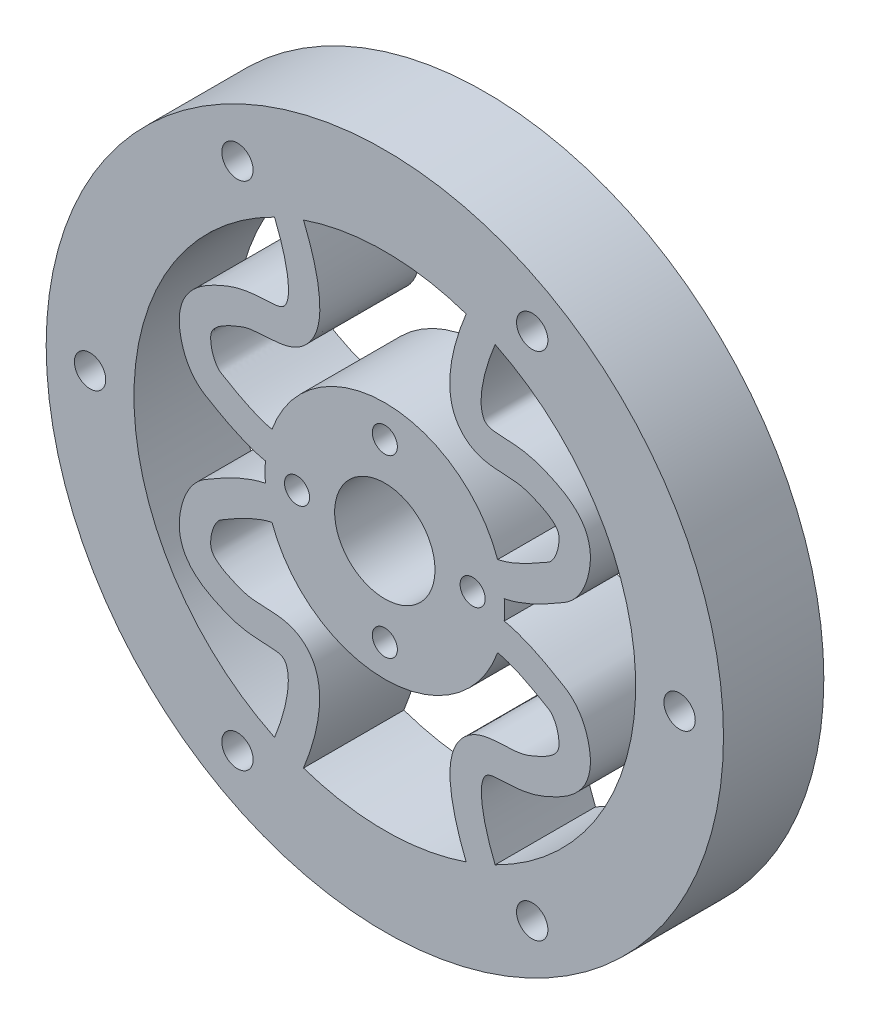
from build123d import *

# Parameters (mm, degrees)
SKETCH1_R           = 27
SKETCH1_R_2         = 4
SKETCH1_R_3         = 1
SKETCH1_R_4         = 1.25
BOSS_EXTRUDE1_DEPTH = 8


with BuildPart() as part:
    # Sketch1 → Boss-Extrude1 (new body)
    with BuildSketch(Plane.XY):
        Circle(SKETCH1_R)
        Circle(SKETCH1_R_2, mode=Mode.SUBTRACT)
        with Locations((0, 7)):
            Circle(SKETCH1_R_3, mode=Mode.SUBTRACT)
        with Locations((7, 0)):
            Circle(SKETCH1_R_3, mode=Mode.SUBTRACT)
        with Locations((0, -7)):
            Circle(SKETCH1_R_3, mode=Mode.SUBTRACT)
        with Locations((-7, 0)):
            Circle(SKETCH1_R_3, mode=Mode.SUBTRACT)
        with Locations((23.5, 0)):
            Circle(SKETCH1_R_4, mode=Mode.SUBTRACT)
        with Locations((-11.75, -20.351596989)):
            Circle(SKETCH1_R_4, mode=Mode.SUBTRACT)
        with Locations((-11.75, 20.351596989)):
            Circle(SKETCH1_R_4, mode=Mode.SUBTRACT)
        with Locations((11.75, -20.351596989)):
            Circle(SKETCH1_R_4, mode=Mode.SUBTRACT)
        with Locations((-23.5, 0)):
            Circle(SKETCH1_R_4, mode=Mode.SUBTRACT)
        with Locations((11.75, 20.351596989)):
            Circle(SKETCH1_R_4, mode=Mode.SUBTRACT)
        with BuildLine():
            ThreePointArc((-9.519212073, 0.770746505), (-9.550363798, 0), (-9.519212073, -0.770746505))
            add(Edge.make_bspline(
                [(-8.79295489, -17.963459402), (-8.789751676, -17.955605283), (-8.756493011, -17.873910254), (-8.674658323, -17.668827597), (-8.47314353, -17.139202024), (-8.181522342, -16.282172452), (-7.873324992, -15.126888182), (-7.687935236, -13.981580908), (-7.686485968, -12.989186569), (-7.881874013, -12.340800811), (-8.105008022, -12.102135272), (-8.426726621, -11.93662341), (-9.255330049, -11.874056746), (-10.061437086, -11.847182272), (-10.979976732, -11.781328167), (-12.037311083, -11.549131456), (-12.900840134, -11.200679798), (-14.053782574, -10.681805535), (-15.230761942, -9.925378086), (-16.128503078, -8.662385101), (-16.433335649, -7.420441445), (-16.36142636, -6.267389777), (-16.068501517, -5.081799092), (-15.596339324, -4.13538804), (-15.106075273, -3.536707787), (-14.774414654, -3.228408392), (-14.488087887, -3.013403395), (-14.214054149, -2.848285897), (-13.840047195, -2.635954373), (-12.932323329, -2.101933051), (-11.3829493, -1.322801643), (-10.154589961, -0.901693789), (-9.522133979, -0.771346853), (-9.519212073, -0.770746505)],
                knots=[0.008784753, 0.008784753, 0.008784753, 0.008784753, 0.01097773, 0.03125, 0.0625, 0.125, 0.1875, 0.25, 0.3125, 0.375, 0.4375, 0.5, 0.53125, 0.5625, 0.59375, 0.625, 0.65625, 0.6875, 0.75, 0.78125, 0.8125, 0.84375, 0.875, 0.90625, 0.921875, 0.9296875, 0.9375, 0.9453125, 0.953125, 0.96875, 0.984375, 0.999644738, 0.99971544, 0.99971544, 0.99971544, 0.99971544], degree=3))
            ThreePointArc((-8.79295489, -17.963459402), (-20.000048234, 9.463e-06), (-8.792937891, 17.963467723))
            add(Edge.make_bspline(
                [(-8.792937891, 17.963467723), (-8.791562262, 17.960126215), (-8.750267497, 17.859747013), (-8.65833601, 17.631351501), (-8.441705375, 17.063028934), (-8.149451429, 16.205056503), (-7.846325361, 15.06368757), (-7.668843885, 13.941955129), (-7.675333506, 12.978050771), (-7.87114636, 12.35652349), (-8.095991929, 12.116873434), (-8.436711213, 11.945998932), (-9.265416298, 11.87785087), (-10.068596518, 11.844262449), (-10.982441815, 11.771781418), (-12.031590736, 11.537373891), (-12.892434133, 11.191428265), (-14.045189381, 10.676092497), (-15.224558498, 9.925230094), (-16.126936546, 8.663277488), (-16.432671595, 7.419151394), (-16.360416899, 6.266683054), (-16.067771702, 5.081083432), (-15.595558083, 4.134593177), (-15.105045207, 3.535835762), (-14.773209288, 3.227530288), (-14.486711652, 3.012529547), (-14.212708995, 2.847515376), (-13.83888204, 2.635324178), (-12.931623587, 2.101508088), (-11.382941981, 1.322630304), (-10.154652478, 0.901642716), (-9.522145294, 0.771348875), (-9.519212073, 0.770746505)],
                knots=[0.003708072, 0.003708072, 0.003708072, 0.003708072, 0.00463509, 0.03125, 0.0625, 0.125, 0.1875, 0.25, 0.3125, 0.375, 0.4375, 0.5, 0.53125, 0.5625, 0.59375, 0.625, 0.65625, 0.6875, 0.75, 0.78125, 0.8125, 0.84375, 0.875, 0.90625, 0.921875, 0.9296875, 0.9375, 0.9453125, 0.953125, 0.96875, 0.984375, 0.999645143, 0.999716115, 0.999716115, 0.999716115, 0.999716115], degree=3))
        make_face(mode=Mode.SUBTRACT)
        with BuildLine():
            ThreePointArc((-8.992854355, -3.215279027), (0, -9.550363798), (8.992854355, -3.215279027))
            add(Edge.make_bspline(
                [(6.482825594, -18.920224673), (6.479643079, -18.912434621), (6.440546178, -18.816583376), (6.346672928, -18.581652119), (6.118118263, -17.980808102), (5.788945543, -17.014197955), (5.428868329, -15.668883374), (5.191072918, -14.23051065), (5.174743858, -12.762208605), (5.523807656, -11.283682639), (6.409177328, -10.167424688), (7.453609958, -9.625573421), (8.349527017, -9.425951182), (9.169805236, -9.377043055), (9.947175883, -9.35117047), (10.674740736, -9.289097944), (11.236716988, -9.1697411), (11.931555202, -8.897082405), (12.637231679, -8.577618745), (13.211384932, -8.234205944), (13.612717299, -7.883089355), (13.812647465, -7.570728835), (13.896433602, -7.282600511), (13.879165384, -6.642379878), (13.730051718, -6.060720657), (13.551428988, -5.654040983), (13.396387154, -5.397598774), (13.264974828, -5.239502142), (13.160322976, -5.144344514), (13.101616979, -5.099234995), (12.979350793, -5.022822963), (12.577708218, -4.794184261), (11.724478645, -4.292467827), (10.60082367, -3.731233705), (9.652287875, -3.377819408), (9.219303852, -3.260663105), (8.992854355, -3.215279027)],
                knots=[0.007766771, 0.007766771, 0.007766771, 0.007766771, 0.009702959, 0.03125, 0.0625, 0.125, 0.1875, 0.25, 0.3125, 0.375, 0.4375, 0.46875, 0.5, 0.53125, 0.5625, 0.59375, 0.625, 0.65625, 0.6875, 0.71875, 0.75, 0.78125, 0.8125, 0.84375, 0.875, 0.890625, 0.90625, 0.921875, 0.9296875, 0.9375, 0.9453125, 0.953125, 0.96875, 0.984375, 0.9921875, 1, 1, 1, 1], degree=3))
            ThreePointArc((6.482825594, -18.920224673), (0, -20.000048234), (-6.482825594, -18.920224673))
            add(Edge.make_bspline(
                [(-6.482825594, -18.920224673), (-6.479643079, -18.912434621), (-6.440546178, -18.816583376), (-6.346672928, -18.581652119), (-6.118118263, -17.980808102), (-5.788945543, -17.014197955), (-5.428868329, -15.668883374), (-5.191072918, -14.23051065), (-5.174743858, -12.762208605), (-5.523807656, -11.283682639), (-6.409177328, -10.167424688), (-7.453609958, -9.625573421), (-8.349527017, -9.425951182), (-9.169805236, -9.377043055), (-9.947175883, -9.35117047), (-10.674740736, -9.289097944), (-11.236716988, -9.1697411), (-11.931555202, -8.897082405), (-12.637231679, -8.577618745), (-13.211384932, -8.234205944), (-13.612717299, -7.883089355), (-13.812647465, -7.570728835), (-13.896433602, -7.282600511), (-13.879165384, -6.642379878), (-13.730051718, -6.060720657), (-13.551428988, -5.654040983), (-13.396387154, -5.397598774), (-13.264974828, -5.239502142), (-13.160322976, -5.144344514), (-13.101616979, -5.099234995), (-12.979350793, -5.022822963), (-12.577708218, -4.794184261), (-11.724478645, -4.292467827), (-10.60082367, -3.731233705), (-9.652287875, -3.377819408), (-9.219303852, -3.260663105), (-8.992854355, -3.215279027)],
                knots=[0.007766771, 0.007766771, 0.007766771, 0.007766771, 0.009702959, 0.03125, 0.0625, 0.125, 0.1875, 0.25, 0.3125, 0.375, 0.4375, 0.46875, 0.5, 0.53125, 0.5625, 0.59375, 0.625, 0.65625, 0.6875, 0.71875, 0.75, 0.78125, 0.8125, 0.84375, 0.875, 0.890625, 0.90625, 0.921875, 0.9296875, 0.9375, 0.9453125, 0.953125, 0.96875, 0.984375, 0.9921875, 1, 1, 1, 1], degree=3))
        make_face(mode=Mode.SUBTRACT)
        with BuildLine():
            ThreePointArc((9.519212073, -0.770746505), (9.550363798, 0), (9.519212073, 0.770746505))
            add(Edge.make_bspline(
                [(8.793318818, 17.963218379), (8.743197293, 17.842214311), (8.651505868, 17.615364074), (8.428006234, 17.0288406), (8.138008467, 16.176595857), (7.838003211, 15.043395883), (7.663538372, 13.930323334), (7.672414939, 12.974755911), (7.868409236, 12.359721076), (8.094314145, 12.119149537), (8.43980684, 11.946965508), (9.268598186, 11.877488925), (10.071089889, 11.842329001), (10.983787483, 11.768300256), (12.03090242, 11.533397682), (12.891077316, 11.188030214), (14.043721238, 10.673507279), (15.223480966, 9.923979767), (16.126726799, 8.66249373), (16.432612099, 7.418147543), (16.360238965, 6.265833202), (16.067584864, 5.080344546), (15.595419621, 4.133992665), (15.105024713, 3.535339458), (14.77327045, 3.227082767), (14.486871953, 3.012125091), (14.212836921, 2.847074129), (13.838864879, 2.634823466), (12.931475766, 2.101093192), (11.382699658, 1.322441506), (10.154530912, 0.901606325), (9.52215874, 0.771351576), (9.519212073, 0.770746505)],
                knots=[0, 0, 0, 0, 0.03125, 0.0625, 0.125, 0.1875, 0.25, 0.3125, 0.375, 0.4375, 0.5, 0.53125, 0.5625, 0.59375, 0.625, 0.65625, 0.6875, 0.75, 0.78125, 0.8125, 0.84375, 0.875, 0.90625, 0.921875, 0.9296875, 0.9375, 0.9453125, 0.953125, 0.96875, 0.984375, 0.99964347, 0.999714776, 0.999714776, 0.999714776, 0.999714776], degree=3))
            ThreePointArc((8.793318818, 17.963218379), (20.000045481, -0.000234035), (8.79295489, -17.963459402))
            add(Edge.make_bspline(
                [(8.79295489, -17.963459402), (8.789751676, -17.955605283), (8.756493011, -17.873910254), (8.674658323, -17.668827597), (8.47314353, -17.139202024), (8.181522342, -16.282172452), (7.873324992, -15.126888182), (7.687935236, -13.981580908), (7.686485968, -12.989186569), (7.881874013, -12.340800811), (8.105008022, -12.102135272), (8.426726621, -11.93662341), (9.255330049, -11.874056746), (10.061437086, -11.847182272), (10.979976732, -11.781328167), (12.037311083, -11.549131456), (12.900840134, -11.200679798), (14.053782574, -10.681805535), (15.230761942, -9.925378086), (16.128503077, -8.662385101), (16.433335649, -7.420441445), (16.36142636, -6.267389777), (16.068501517, -5.081799092), (15.596339324, -4.13538804), (15.106075273, -3.536707787), (14.774414654, -3.228408392), (14.488087887, -3.013403395), (14.214054149, -2.848285897), (13.840047195, -2.635954373), (12.932323329, -2.101933051), (11.3829493, -1.322801643), (10.154589961, -0.901693789), (9.522133979, -0.771346853), (9.519212073, -0.770746505)],
                knots=[0.008784753, 0.008784753, 0.008784753, 0.008784753, 0.01097773, 0.03125, 0.0625, 0.125, 0.1875, 0.25, 0.3125, 0.375, 0.4375, 0.5, 0.53125, 0.5625, 0.59375, 0.625, 0.65625, 0.6875, 0.75, 0.78125, 0.8125, 0.84375, 0.875, 0.90625, 0.921875, 0.9296875, 0.9375, 0.9453125, 0.953125, 0.96875, 0.984375, 0.999644738, 0.99971544, 0.99971544, 0.99971544, 0.99971544], degree=3))
        make_face(mode=Mode.SUBTRACT)
        with BuildLine():
            ThreePointArc((8.992854355, 3.215279027), (0, 9.550363798), (-8.992854355, 3.215279027))
            add(Edge.make_bspline(
                [(-6.482730882, 18.920257125), (-6.481357821, 18.916924027), (-6.434399602, 18.802861466), (-6.330701066, 18.545377344), (-6.087016997, 17.906029612), (-5.756543802, 16.936809876), (-5.400327587, 15.600833855), (-5.170127048, 14.178161761), (-5.163909696, 12.726649856), (-5.528940794, 11.262631501), (-6.421625851, 10.168582686), (-7.456414954, 9.637035594), (-8.34310286, 9.435914775), (-9.158963912, 9.380779136), (-9.934006751, 9.348462034), (-10.661569297, 9.281317237), (-11.22941997, 9.15835602), (-11.927728827, 8.885014141), (-12.635544248, 8.566793201), (-13.211423415, 8.225093601), (-13.613053058, 7.876062007), (-13.811677363, 7.566988268), (-13.894989912, 7.282057166), (-13.877739641, 6.640738219), (-13.728682956, 6.059400104), (-13.550186706, 5.652972791), (-13.395244724, 5.396758929), (-13.263897961, 5.238802562), (-13.15922722, 5.143680622), (-13.100472232, 5.098556794), (-12.977942664, 5.022027734), (-12.576086656, 4.793326813), (-11.723279322, 4.29180674), (-10.600317935, 3.730910578), (-9.65222819, 3.377728779), (-9.219265154, 3.260629732), (-8.992854355, 3.215279027)],
                knots=[0.003301299, 0.003301299, 0.003301299, 0.003301299, 0.004126624, 0.03125, 0.0625, 0.125, 0.1875, 0.25, 0.3125, 0.375, 0.4375, 0.46875, 0.5, 0.53125, 0.5625, 0.59375, 0.625, 0.65625, 0.6875, 0.71875, 0.75, 0.78125, 0.8125, 0.84375, 0.875, 0.890625, 0.90625, 0.921875, 0.9296875, 0.9375, 0.9453125, 0.953125, 0.96875, 0.984375, 0.9921875, 1, 1, 1, 1], degree=3))
            ThreePointArc((-6.482730882, 18.920257125), (0.000281493, 20.000048232), (6.48326347, 18.920074634))
            add(Edge.make_bspline(
                [(6.48326347, 18.920074634), (6.426969184, 18.784168204), (6.323926396, 18.529240191), (6.073238618, 17.871328767), (5.744805977, 16.907111706), (5.391475966, 15.577966261), (5.164397524, 14.161929714), (5.161437973, 12.715977906), (5.530830467, 11.256294227), (6.425185299, 10.167861151), (7.457773191, 9.638640592), (8.342471897, 9.437117849), (9.157349955, 9.380525303), (9.931849038, 9.346695933), (10.659368927, 9.278355576), (11.228458067, 9.154567491), (11.927518469, 8.881074749), (12.635776715, 8.563143177), (13.211970046, 8.221868708), (13.613558474, 7.873391688), (13.811756524, 7.565229996), (13.894899912, 7.281280641), (13.877647996, 6.639933014), (13.728566933, 6.058675927), (13.550080559, 5.652289851), (13.395162417, 5.396116901), (13.263855365, 5.238202934), (13.159243026, 5.143126111), (13.100533395, 5.098033712), (12.978142673, 5.021581255), (12.576396259, 4.792966806), (11.723496187, 4.291557777), (10.600391857, 3.730785638), (9.652220864, 3.377684544), (9.219264876, 3.260618657), (8.992854355, 3.215279027)],
                knots=[0, 0, 0, 0, 0.03125, 0.0625, 0.125, 0.1875, 0.25, 0.3125, 0.375, 0.4375, 0.46875, 0.5, 0.53125, 0.5625, 0.59375, 0.625, 0.65625, 0.6875, 0.71875, 0.75, 0.78125, 0.8125, 0.84375, 0.875, 0.890625, 0.90625, 0.921875, 0.9296875, 0.9375, 0.9453125, 0.953125, 0.96875, 0.984375, 0.9921875, 1, 1, 1, 1], degree=3))
        make_face(mode=Mode.SUBTRACT)
    extrude(amount=BOSS_EXTRUDE1_DEPTH)


solid = part.part
